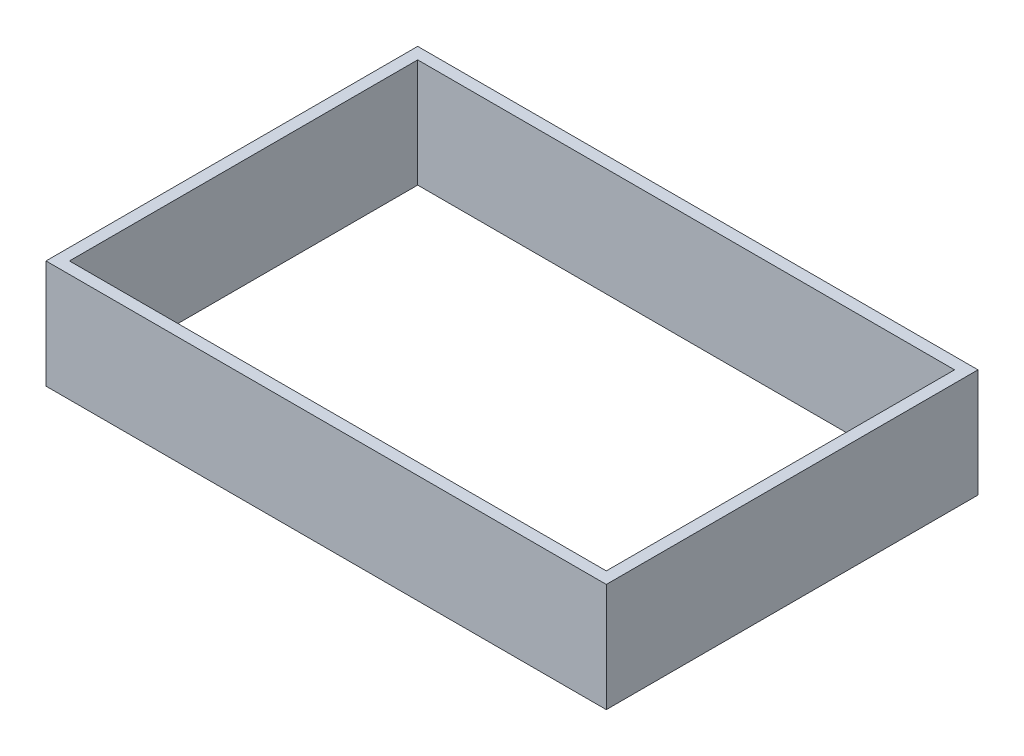
from build123d import *

# Parameters (mm, degrees)
SKETCH_2_W      = 2
SKETCH_2_H      = 10.4
SKETCH_2_H_2    = 18.3
SKETCH_2_H_3    = 13
EXTRUDE_1_DEPTH = 18.5


with BuildPart() as part:
    # 草图2 → 凸台-拉伸1 (new body)
    with BuildSketch(Plane(origin=(0, 0, 0), x_dir=(1, 0, 0), z_dir=(0, 1, 0))):
        Polygon((-0.2, 4.564103951), (-0.2, 5.3), (-2.2, 5.3), (-2.2, -2.2), (76.17, -2.2), (76.17, -0.2), (74.17, -0.2), (16.8, -0.2), (-0.2, -0.2), align=None)
        with Locations((-1.2, 10.5)):
            Rectangle(SKETCH_2_W, SKETCH_2_H)
        with Locations((-1.2, 24.85)):
            Rectangle(SKETCH_2_W, SKETCH_2_H_2)
        with Locations((-1.2, 40.5)):
            Rectangle(SKETCH_2_W, SKETCH_2_H_3)
        Polygon((-0.2, 50.2), (-0.2, 59.2), (13.8, 59.2), (16.8, 59.2), (74.17, 59.2), (76.17, 59.2), (91.37, 59.2), (91.37, -0.2), (76.17, -0.2), (76.17, -2.2), (93.37, -2.2), (93.37, 61.2), (-2.2, 61.2), (-2.2, 47), (-0.2, 47), align=None)
    extrude(amount=-EXTRUDE_1_DEPTH)


solid = part.part
